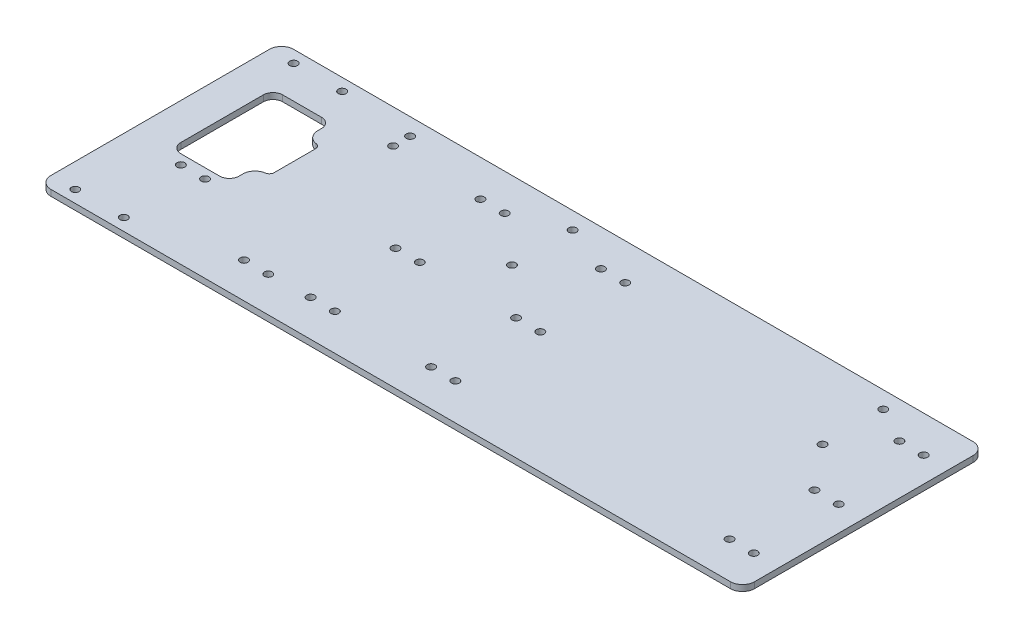
from build123d import *

# Parameters (mm, degrees)
SKETCH1_W           = 368.3
SKETCH1_H           = 127
SKETCH1_R           = 2.032
BOSS_EXTRUDE1_DEPTH = 3.175
FILLET1_R           = 5.08
FILLET3_R           = 6.35
FILLET4_R           = 2.54
FILLET5_R           = 6.35
CUT_EXTRUDE1_REACH  = 196.817
SKETCH2_R           = 2.032


with BuildPart() as part:
    # Sketch1 → Boss-Extrude1 (new body)
    with BuildSketch(Plane(origin=(0, 0, 0), x_dir=(1, 0, 0), z_dir=(0, 1, 0))):
        Rectangle(SKETCH1_W, SKETCH1_H)
        with Locations(Location((-171.45, -57.15, 0), (0, 0, 270))):
            Circle(SKETCH1_R, mode=Mode.SUBTRACT)
        with Locations(Location((-146.05, -57.15, 0), (0, 0, 270))):
            Circle(SKETCH1_R, mode=Mode.SUBTRACT)
        with Locations(Location((-95.25, -45.0215, 0), (0, 0, 270))):
            Circle(SKETCH1_R, mode=Mode.SUBTRACT)
        with Locations(Location((-82.55, -45.0215, 0), (0, 0, 270))):
            Circle(SKETCH1_R, mode=Mode.SUBTRACT)
        with Locations(Location((-60.9677978, -44.45, 0), (0, 0, 270))):
            Circle(SKETCH1_R, mode=Mode.SUBTRACT)
        with Locations(Location((-48.2677978, -44.45, 0), (0, 0, 270))):
            Circle(SKETCH1_R, mode=Mode.SUBTRACT)
        with Locations(Location((-154.94, -18.415, 0), (0, 0, 270))):
            Circle(SKETCH1_R, mode=Mode.SUBTRACT)
        with Locations(Location((-142.24, -18.415, 0), (0, 0, 270))):
            Circle(SKETCH1_R, mode=Mode.SUBTRACT)
        with Locations(Location((2.1088604, -44.45, 0), (0, 0, 270))):
            Circle(SKETCH1_R, mode=Mode.SUBTRACT)
        with Locations(Location((14.8088604, -44.45, 0), (0, 0, 270))):
            Circle(SKETCH1_R, mode=Mode.SUBTRACT)
        with Locations(Location((158.3188604, -44.45, 0), (0, 0, 270))):
            Circle(SKETCH1_R, mode=Mode.SUBTRACT)
        with Locations(Location((171.0188604, -44.45, 0), (0, 0, 270))):
            Circle(SKETCH1_R, mode=Mode.SUBTRACT)
        Polygon((-134.618428208, -13.335), (-165.098428208, -13.335), (-165.098428208, 40.005), (-134.618428208, 40.005), (-134.618428208, 26.67), (-126.998428208, 26.67), (-126.998428208, 0), (-134.618428208, 0), align=None, mode=Mode.SUBTRACT)
        with Locations(Location((-60.9677978, 0, 0), (0, 0, 270))):
            Circle(SKETCH1_R, mode=Mode.SUBTRACT)
        with Locations(Location((-48.2677978, 0, 0), (0, 0, 270))):
            Circle(SKETCH1_R, mode=Mode.SUBTRACT)
        with Locations(Location((-171.45, 57.15, 0), (0, 0, 270))):
            Circle(SKETCH1_R, mode=Mode.SUBTRACT)
        with Locations(Location((-146.05, 57.15, 0), (0, 0, 270))):
            Circle(SKETCH1_R, mode=Mode.SUBTRACT)
        with Locations(Location((-60.9677978, 44.45, 0), (0, 0, 270))):
            Circle(SKETCH1_R, mode=Mode.SUBTRACT)
        with Locations(Location((-48.2677978, 44.45, 0), (0, 0, 270))):
            Circle(SKETCH1_R, mode=Mode.SUBTRACT)
        with Locations(Location((2.1088604, 0, 0), (0, 0, 270))):
            Circle(SKETCH1_R, mode=Mode.SUBTRACT)
        with Locations(Location((14.8088604, 0, 0), (0, 0, 270))):
            Circle(SKETCH1_R, mode=Mode.SUBTRACT)
        with Locations(Location((158.3188604, 0, 0), (0, 0, 270))):
            Circle(SKETCH1_R, mode=Mode.SUBTRACT)
        with Locations(Location((171.0188604, 0, 0), (0, 0, 270))):
            Circle(SKETCH1_R, mode=Mode.SUBTRACT)
        with Locations(Location((2.1088604, 44.45, 0), (0, 0, 270))):
            Circle(SKETCH1_R, mode=Mode.SUBTRACT)
        with Locations(Location((14.8088604, 44.45, 0), (0, 0, 270))):
            Circle(SKETCH1_R, mode=Mode.SUBTRACT)
        with Locations(Location((158.3188604, 44.45, 0), (0, 0, 270))):
            Circle(SKETCH1_R, mode=Mode.SUBTRACT)
        with Locations(Location((171.0188604, 44.45, 0), (0, 0, 270))):
            Circle(SKETCH1_R, mode=Mode.SUBTRACT)
    extrude(amount=BOSS_EXTRUDE1_DEPTH)

    # Fillet1
    fillet1_edges = [part.edges().sort_by_distance(p)[0] for p in [
        (-134.618428208, 1.5875, -40.005),
        (-165.098428208, 1.5875, -40.005),
        (-165.098428208, 1.5875, 13.335),
        (-134.618428208, 1.5875, 13.335),
    ]]
    fillet(fillet1_edges, radius=FILLET1_R)

    # Fillet3
    fillet3_edges = [part.edges().sort_by_distance(p)[0] for p in [
        (184.15, 1.5875, -63.5),
        (184.15, 1.5875, 63.5),
        (-184.15, 1.5875, 63.5),
        (-184.15, 1.5875, -63.5),
    ]]
    fillet(fillet3_edges, radius=FILLET3_R)

    # Fillet4
    fillet4_edges = [part.edges().sort_by_distance(p)[0] for p in [
        (-126.998428208, 1.5875, -26.67),
        (-126.998428208, 1.5875, 0),
    ]]
    fillet(fillet4_edges, radius=FILLET4_R)

    # Fillet5
    fillet5_edges = [part.edges().sort_by_distance(p)[0] for p in [
        (-134.618428208, 1.5875, 0),
        (-134.618428208, 1.5875, -26.67),
    ]]
    fillet(fillet5_edges, radius=FILLET5_R)

    # Sketch2 → Cut-Extrude1 (cut, up to next)
    with BuildSketch(Plane(origin=(0, 3.175, 0), x_dir=(1, 0, 0), z_dir=(0, 1, 0)), mode=Mode.PRIVATE) as cut_extrude1_sk1:
        with Locations(Location((139.7, 22.86, 0), (0, 0, 270))):
            Circle(SKETCH2_R)
    cut_extrude1_tool1 = extrude(cut_extrude1_sk1.sketch, amount=-CUT_EXTRUDE1_REACH, mode=Mode.PRIVATE) & part.part
    # Sketch2 → Cut-Extrude1 (cut, up to next)
    with BuildSketch(Plane(origin=(0, 3.175, 0), x_dir=(1, 0, 0), z_dir=(0, 1, 0)), mode=Mode.PRIVATE) as cut_extrude1_sk2:
        with Locations(Location((139.7, 54.61, 0), (0, 0, 270))):
            Circle(SKETCH2_R)
    cut_extrude1_tool2 = extrude(cut_extrude1_sk2.sketch, amount=-CUT_EXTRUDE1_REACH, mode=Mode.PRIVATE) & part.part
    # Sketch2 → Cut-Extrude1 (cut, up to next)
    with BuildSketch(Plane(origin=(0, 3.175, 0), x_dir=(1, 0, 0), z_dir=(0, 1, 0)), mode=Mode.PRIVATE) as cut_extrude1_sk3:
        with Locations(Location((-22.86, 54.61, 0), (0, 0, 270))):
            Circle(SKETCH2_R)
    cut_extrude1_tool3 = extrude(cut_extrude1_sk3.sketch, amount=-CUT_EXTRUDE1_REACH, mode=Mode.PRIVATE) & part.part
    # Sketch2 → Cut-Extrude1 (cut, up to next)
    with BuildSketch(Plane(origin=(0, 3.175, 0), x_dir=(1, 0, 0), z_dir=(0, 1, 0)), mode=Mode.PRIVATE) as cut_extrude1_sk4:
        with Locations(Location((-22.86, 22.86, 0), (0, 0, 270))):
            Circle(SKETCH2_R)
    cut_extrude1_tool4 = extrude(cut_extrude1_sk4.sketch, amount=-CUT_EXTRUDE1_REACH, mode=Mode.PRIVATE) & part.part
    # Sketch2 → Cut-Extrude1 (cut, up to next)
    with BuildSketch(Plane(origin=(0, 3.175, 0), x_dir=(1, 0, 0), z_dir=(0, 1, 0)), mode=Mode.PRIVATE) as cut_extrude1_sk5:
        with Locations(Location((-107.95, 54.61, 0), (0, 0, 270))):
            Circle(SKETCH2_R)
    cut_extrude1_tool5 = extrude(cut_extrude1_sk5.sketch, amount=-CUT_EXTRUDE1_REACH, mode=Mode.PRIVATE) & part.part
    # Sketch2 → Cut-Extrude1 (cut, up to next)
    with BuildSketch(Plane(origin=(0, 3.175, 0), x_dir=(1, 0, 0), z_dir=(0, 1, 0)), mode=Mode.PRIVATE) as cut_extrude1_sk6:
        with Locations(Location((-107.95, 45.72, 0), (0, 0, 270))):
            Circle(SKETCH2_R)
    cut_extrude1_tool6 = extrude(cut_extrude1_sk6.sketch, amount=-CUT_EXTRUDE1_REACH, mode=Mode.PRIVATE) & part.part
    add(cut_extrude1_tool1.solids().sort_by_distance((139.7, 3.175, -22.86))[0], mode=Mode.SUBTRACT)
    add(cut_extrude1_tool2.solids().sort_by_distance((139.7, 3.175, -54.61))[0], mode=Mode.SUBTRACT)
    add(cut_extrude1_tool3.solids().sort_by_distance((-22.86, 3.175, -54.61))[0], mode=Mode.SUBTRACT)
    add(cut_extrude1_tool4.solids().sort_by_distance((-22.86, 3.175, -22.86))[0], mode=Mode.SUBTRACT)
    add(cut_extrude1_tool5.solids().sort_by_distance((-107.95, 3.175, -54.61))[0], mode=Mode.SUBTRACT)
    add(cut_extrude1_tool6.solids().sort_by_distance((-107.95, 3.175, -45.72))[0], mode=Mode.SUBTRACT)


solid = part.part
